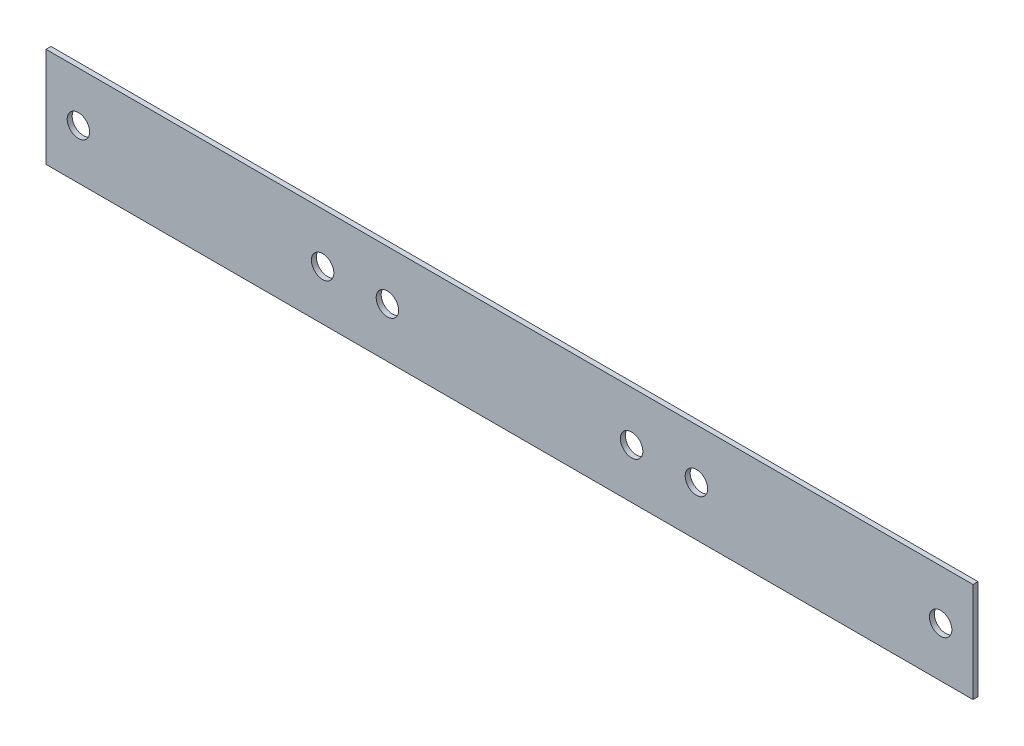
from build123d import *

# Parameters (mm, degrees)
M4_BACKING_HOLES_PROFILE_W = 186
M4_BACKING_HOLES_PROFILE_H = 20
M4_BACKING_HOLES_PROFILE_R = 2.25
M4_BACKING_HOLES_DEPTH     = 1


with BuildPart() as part:
    # M4 backing holes profile → M4 backing holes (new body)
    with BuildSketch(Plane.XY):
        with Locations((-6, 0)):
            Rectangle(M4_BACKING_HOLES_PROFILE_W, M4_BACKING_HOLES_PROFILE_H)
        with Locations((-92.5, 0)):
            Circle(M4_BACKING_HOLES_PROFILE_R, mode=Mode.SUBTRACT)
        with Locations((-43.5, 0)):
            Circle(M4_BACKING_HOLES_PROFILE_R, mode=Mode.SUBTRACT)
        with Locations((-30.5, 0)):
            Circle(M4_BACKING_HOLES_PROFILE_R, mode=Mode.SUBTRACT)
        with Locations((18.5, 0)):
            Circle(M4_BACKING_HOLES_PROFILE_R, mode=Mode.SUBTRACT)
        with Locations((31.5, 0)):
            Circle(M4_BACKING_HOLES_PROFILE_R, mode=Mode.SUBTRACT)
        with Locations((80.5, 0)):
            Circle(M4_BACKING_HOLES_PROFILE_R, mode=Mode.SUBTRACT)
    extrude(amount=M4_BACKING_HOLES_DEPTH)


solid = part.part
